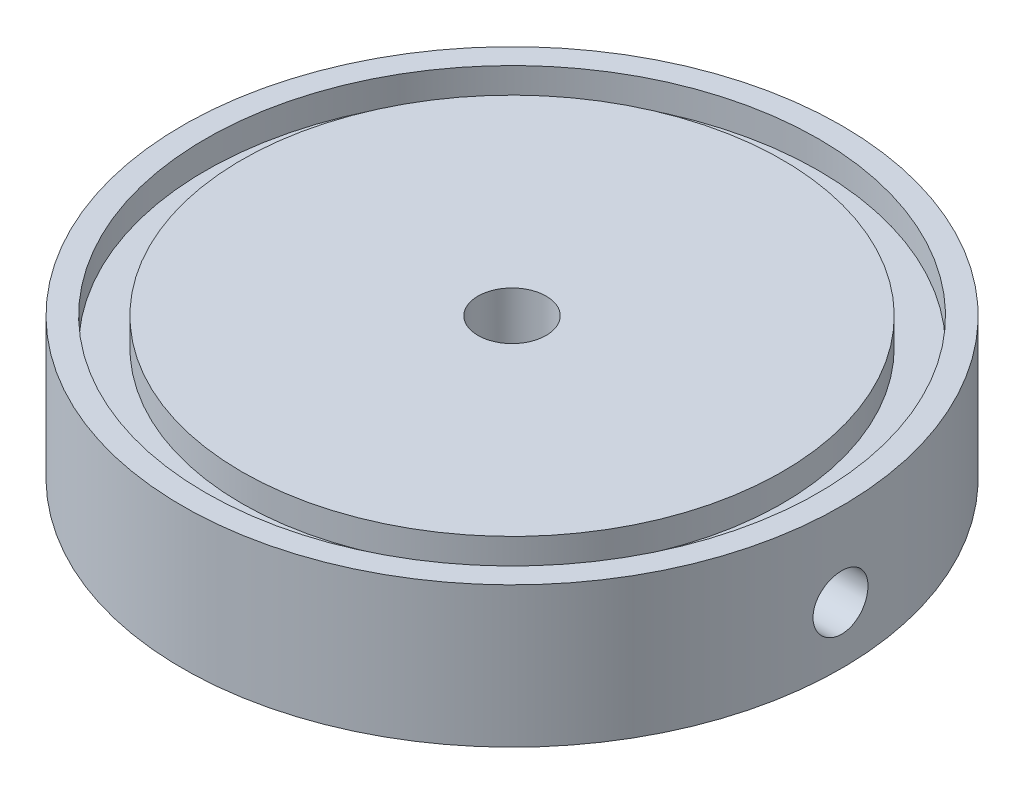
from build123d import *

# Parameters (mm, degrees)
SKETCH2_R          = 1.7272
CUT_EXTRUDE1_DEPTH = 55.599698738
SKETCH3_R          = 35.433
SKETCH3_R_2        = 31.242
CUT_EXTRUDE2_DEPTH = 3.175
SKETCH4_R          = 1.03251
CUT_EXTRUDE3_DEPTH = 3.175
CIRPATTERN1_COUNT  = 9
SKETCH5_R          = 3.175
CUT_EXTRUDE4_DEPTH = 9.525
FILLET1_R          = 1.27


with BuildPart() as part:
    # Sketch1 → Revolve1 (revolve)
    with BuildSketch(Plane.XY, mode=Mode.PRIVATE) as revolve1_sk:
        with BuildLine():
            Line((3.94335, 7.43458), (38.1, 7.43458))
            Line((38.1, 7.43458), (38.1, -8.82142))
            Line((38.1, -8.82142), (22.6695, -8.82142))
            Line((22.6695, -8.82142), (22.6695, -7.8105))
            Line((22.6695, -7.8105), (21.1455, -7.8105))
            Line((21.1455, -7.8105), (21.1455, -8.8265))
            Line((21.1455, -8.8265), (10.9855, -8.8265))
            Line((10.9855, -8.8265), (10.9855, -6.391948453))
            ThreePointArc((10.9855, -6.391948453), (10.570616467, -5.000733157), (9.4615, -4.064))
            Line((9.4615, -4.064), (3.94335, 0))
            Line((3.94335, 0), (3.94335, 7.43458))
        make_face()
    revolve(revolve1_sk.sketch.rotate(Axis((0, 101.60464546, 0), (0, 1, 0)), 90), axis=Axis((0, 101.60464546, 0), (0, 1, 0)))

    # Sketch2 → Cut-Extrude1 (cut, through all)
    with BuildSketch(Plane(origin=(0, 0, 0), x_dir=(0, 0, -1), z_dir=(1, 0, 0))):
        with Locations(Location((0, -2.21742, 0), (0, 0, 270))):
            Circle(SKETCH2_R)
    extrude(amount=CUT_EXTRUDE1_DEPTH, mode=Mode.SUBTRACT)

    # Sketch3 → Cut-Extrude2 (cut)
    with BuildSketch(Plane(origin=(0, 7.43458, 0), x_dir=(1, 0, 0), z_dir=(0, 1, 0))):
        with Locations(Location((0, 0, 0), (0, 0, 270))):
            Circle(SKETCH3_R)
        with Locations(Location((0, 0, 0), (0, 0, 270))):
            Circle(SKETCH3_R_2, mode=Mode.SUBTRACT)
    extrude(amount=-CUT_EXTRUDE2_DEPTH, mode=Mode.SUBTRACT)

    # Sketch4 → Cut-Extrude3 (cut)
    with BuildSketch(Plane(origin=(0, -8.82142, 0), x_dir=(-1, 0, 0), z_dir=(0, -1, 0))):
        with Locations(Location((-13.97, 24.196749782, 0), (0, 0, 90))):
            Circle(SKETCH4_R)
    cut_extrude3 = extrude(amount=-CUT_EXTRUDE3_DEPTH, mode=Mode.SUBTRACT)

    # CirPattern1: Cut-Extrude3 ×9 about axis
    cirpattern1_axis = Axis((0, 0, 0), (0, 1, 0))
    for i in range(1, CIRPATTERN1_COUNT):
        add(cut_extrude3.rotate(cirpattern1_axis, i * 360 / CIRPATTERN1_COUNT), mode=Mode.SUBTRACT)

    # Sketch5 → Cut-Extrude4 (cut)
    with BuildSketch(Plane(origin=(38.1, 0, 0), x_dir=(0, 0, -1), z_dir=(1, 0, 0))):
        with Locations((0, -2.21742)):
            Circle(SKETCH5_R)
    extrude(amount=-CUT_EXTRUDE4_DEPTH, mode=Mode.SUBTRACT)

    # Fillet1
    fillet1_edges = [part.edges().sort_by_distance(p)[0] for p in [
        (0, 0, 3.94335),
    ]]
    fillet(fillet1_edges, radius=FILLET1_R)


solid = part.part
